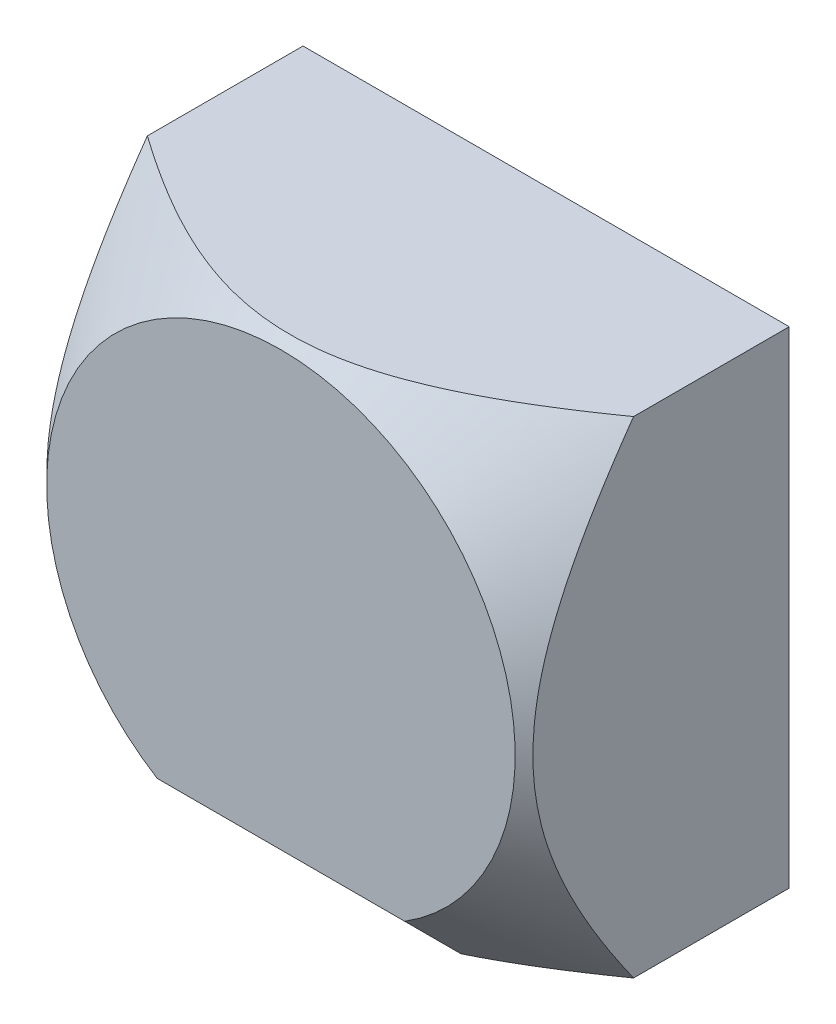
from build123d import *

# Parameters (mm, degrees)
CROQUIS1_W              = 55
CROQUIS1_H              = 55
SALIENTE_EXTRUIR1_DEPTH = 30
CORTAR_EXTRUIR1_REACH   = 70.42


with BuildPart() as part:
    # Croquis1 → Saliente-Extruir1 (new body)
    with BuildSketch(Plane.XY):
        Rectangle(CROQUIS1_W, CROQUIS1_H)
    extrude(amount=-SALIENTE_EXTRUIR1_DEPTH)

    # Croquis2 → Cortar-Revolución1 (revolve, cut)
    with BuildSketch(Plane(origin=(0, 0, 0), x_dir=(0, 0, -1), z_dir=(1, 0, 0)), mode=Mode.PRIVATE) as cortar_revoluci_n1_sk:
        Polygon((0, 26.5), (0, 46.5), (20, 46.5), align=None)
    revolve(cortar_revoluci_n1_sk.sketch.rotate(Axis((0, 0, 0), (0, 0, 1)), 90), axis=Axis((0, 0, 0), (0, 0, 1)), mode=Mode.SUBTRACT)

    # Croquis3 → Cortar-Extruir1 (cut, up to next)
    with BuildSketch(Plane(origin=(27.5, 0, 0), x_dir=(0, 0, -1), z_dir=(1, 0, 0)), mode=Mode.PRIVATE) as cortar_extruir1_sk1:
        Polygon((0, -22.5), (0, -27.5), (5, -27.5), align=None)
    cortar_extruir1_tool1 = extrude(cortar_extruir1_sk1.sketch, amount=-CORTAR_EXTRUIR1_REACH, mode=Mode.PRIVATE) & part.part
    add(cortar_extruir1_tool1.solids().sort_by_distance((27.5, -25.833333, -1.666667))[0], mode=Mode.SUBTRACT)


solid = part.part
